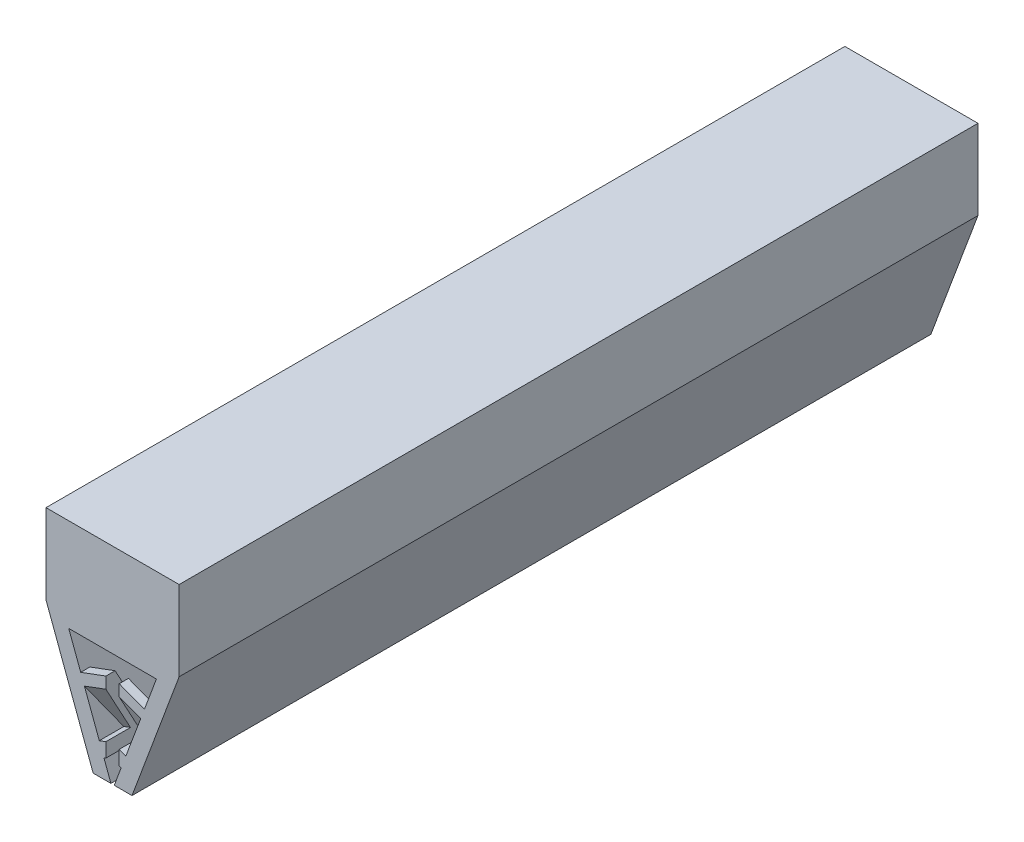
from build123d import *

# Parameters (mm, degrees)
SALIENTE_EXTRUIR1_DEPTH = 60
SALIENTE_EXTRUIR2_REACH = 64.405


with BuildPart() as part:
    # Croquis1 → Saliente-Extruir1 (new, symmetric)
    with BuildSketch(Plane.XY):
        Polygon((-0.25, -17), (-2.91801894, -17), (-10, 2), (-10, 14), (0, 14), (0, 0), (-6.586509369, 0), align=None)
    saliente_extruir1 = extrude(amount=SALIENTE_EXTRUIR1_DEPTH, both=True)

    # Saliente-Extruir2: up to this plane
    saliente_extruir2_end = Plane(origin=(-1, 0, 0), z_dir=(1, 0, 0))
    # Croquis2 → Saliente-Extruir2 (add, up to the surface)
    with BuildSketch(Plane(origin=(-5.783057557, -2.155552847, 0), x_dir=(0, 0, -1), z_dir=(0.9370248323365327, 0.3492627429095367, 0)), mode=Mode.PRIVATE) as saliente_extruir2_sk1:
        Polygon((-60, -12.842106464), (0, -12.842106464), (0, -10.842106464), (-4, -10.842106464), (-6.309401077, -10.842106464), (-14, -10.842106464), (-16.309401077, -10.842106464), (-24, -10.842106464), (-26.309401077, -10.842106464), (-34, -10.842106464), (-36.309401077, -10.842106464), (-44, -10.842106464), (-46.309401077, -10.842106464), (-54, -10.842106464), (-56.309401077, -10.842106464), (-60, -10.842106464), align=None)
    saliente_extruir2_tool1 = split(extrude(saliente_extruir2_sk1.sketch, amount=SALIENTE_EXTRUIR2_REACH, mode=Mode.PRIVATE), bisect_by=saliente_extruir2_end, keep=Keep.BOTH, mode=Mode.PRIVATE)
    # Croquis2 → Saliente-Extruir2 (add, up to the surface)
    with BuildSketch(Plane(origin=(-5.783057557, -2.155552847, 0), x_dir=(0, 0, -1), z_dir=(0.9370248323365327, 0.3492627429095367, 0)), mode=Mode.PRIVATE) as saliente_extruir2_sk2:
        Polygon((-60, -4.449801619), (-56.309401077, -10.842106464), (-54, -10.842106464), (-58.618802154, -2.842106464), (-60, -2.842106464), align=None)
    saliente_extruir2_tool2 = split(extrude(saliente_extruir2_sk2.sketch, amount=SALIENTE_EXTRUIR2_REACH, mode=Mode.PRIVATE), bisect_by=saliente_extruir2_end, keep=Keep.BOTH, mode=Mode.PRIVATE)
    # Croquis2 → Saliente-Extruir2 (add, up to the surface)
    with BuildSketch(Plane(origin=(-5.783057557, -2.155552847, 0), x_dir=(0, 0, -1), z_dir=(0.9370248323365327, 0.3492627429095367, 0)), mode=Mode.PRIVATE) as saliente_extruir2_sk3:
        Polygon((-26.309401077, -10.842106464), (-24, -10.842106464), (-28.618802154, -2.842106464), (-30.92820323, -2.842106464), align=None)
    saliente_extruir2_tool3 = split(extrude(saliente_extruir2_sk3.sketch, amount=SALIENTE_EXTRUIR2_REACH, mode=Mode.PRIVATE), bisect_by=saliente_extruir2_end, keep=Keep.BOTH, mode=Mode.PRIVATE)
    # Croquis2 → Saliente-Extruir2 (add, up to the surface)
    with BuildSketch(Plane(origin=(-5.783057557, -2.155552847, 0), x_dir=(0, 0, -1), z_dir=(0.9370248323365327, 0.3492627429095367, 0)), mode=Mode.PRIVATE) as saliente_extruir2_sk4:
        Polygon((-16.309401077, -10.842106464), (-14, -10.842106464), (-18.618802154, -2.842106464), (-20.92820323, -2.842106464), align=None)
    saliente_extruir2_tool4 = split(extrude(saliente_extruir2_sk4.sketch, amount=SALIENTE_EXTRUIR2_REACH, mode=Mode.PRIVATE), bisect_by=saliente_extruir2_end, keep=Keep.BOTH, mode=Mode.PRIVATE)
    # Croquis2 → Saliente-Extruir2 (add, up to the surface)
    with BuildSketch(Plane(origin=(-5.783057557, -2.155552847, 0), x_dir=(0, 0, -1), z_dir=(0.9370248323365327, 0.3492627429095367, 0)), mode=Mode.PRIVATE) as saliente_extruir2_sk5:
        Polygon((28.618802154, -2.842106464), (24, -10.842106464), (26.309401077, -10.842106464), (30.92820323, -2.842106464), align=None)
    saliente_extruir2_tool5 = split(extrude(saliente_extruir2_sk5.sketch, amount=SALIENTE_EXTRUIR2_REACH, mode=Mode.PRIVATE), bisect_by=saliente_extruir2_end, keep=Keep.BOTH, mode=Mode.PRIVATE)
    # Croquis2 → Saliente-Extruir2 (add, up to the surface)
    with BuildSketch(Plane(origin=(-5.783057557, -2.155552847, 0), x_dir=(0, 0, -1), z_dir=(0.9370248323365327, 0.3492627429095367, 0)), mode=Mode.PRIVATE) as saliente_extruir2_sk6:
        Polygon((34, -10.842106464), (36.309401077, -10.842106464), (40.92820323, -2.842106464), (38.618802154, -2.842106464), align=None)
    saliente_extruir2_tool6 = split(extrude(saliente_extruir2_sk6.sketch, amount=SALIENTE_EXTRUIR2_REACH, mode=Mode.PRIVATE), bisect_by=saliente_extruir2_end, keep=Keep.BOTH, mode=Mode.PRIVATE)
    # Croquis2 → Saliente-Extruir2 (add, up to the surface)
    with BuildSketch(Plane(origin=(-5.783057557, -2.155552847, 0), x_dir=(0, 0, -1), z_dir=(0.9370248323365327, 0.3492627429095367, 0)), mode=Mode.PRIVATE) as saliente_extruir2_sk7:
        Polygon((44, -10.842106464), (46.309401077, -10.842106464), (50.92820323, -2.842106464), (48.618802154, -2.842106464), align=None)
    saliente_extruir2_tool7 = split(extrude(saliente_extruir2_sk7.sketch, amount=SALIENTE_EXTRUIR2_REACH, mode=Mode.PRIVATE), bisect_by=saliente_extruir2_end, keep=Keep.BOTH, mode=Mode.PRIVATE)
    # Croquis2 → Saliente-Extruir2 (add, up to the surface)
    with BuildSketch(Plane(origin=(-5.783057557, -2.155552847, 0), x_dir=(0, 0, -1), z_dir=(0.9370248323365327, 0.3492627429095367, 0)), mode=Mode.PRIVATE) as saliente_extruir2_sk8:
        Polygon((54, -10.842106464), (56.309401077, -10.842106464), (60, -4.449801619), (60, -2.842106464), (58.618802154, -2.842106464), align=None)
    saliente_extruir2_tool8 = split(extrude(saliente_extruir2_sk8.sketch, amount=SALIENTE_EXTRUIR2_REACH, mode=Mode.PRIVATE), bisect_by=saliente_extruir2_end, keep=Keep.BOTH, mode=Mode.PRIVATE)
    # Croquis2 → Saliente-Extruir2 (add, up to the surface)
    with BuildSketch(Plane(origin=(-5.783057557, -2.155552847, 0), x_dir=(0, 0, -1), z_dir=(0.9370248323365327, 0.3492627429095367, 0)), mode=Mode.PRIVATE) as saliente_extruir2_sk9:
        Polygon((0, -12.842106464), (60, -12.842106464), (60, -10.842106464), (56.309401077, -10.842106464), (54, -10.842106464), (46.309401077, -10.842106464), (44, -10.842106464), (36.309401077, -10.842106464), (34, -10.842106464), (26.309401077, -10.842106464), (24, -10.842106464), (16.309401077, -10.842106464), (14, -10.842106464), (6.309401077, -10.842106464), (4, -10.842106464), (0, -10.842106464), align=None)
    saliente_extruir2_tool9 = split(extrude(saliente_extruir2_sk9.sketch, amount=SALIENTE_EXTRUIR2_REACH, mode=Mode.PRIVATE), bisect_by=saliente_extruir2_end, keep=Keep.BOTH, mode=Mode.PRIVATE)
    # Croquis2 → Saliente-Extruir2 (add, up to the surface)
    with BuildSketch(Plane(origin=(-5.783057557, -2.155552847, 0), x_dir=(0, 0, -1), z_dir=(0.9370248323365327, 0.3492627429095367, 0)), mode=Mode.PRIVATE) as saliente_extruir2_sk10:
        Polygon((-44, -10.842106464), (-48.618802154, -2.842106464), (-50.92820323, -2.842106464), (-46.309401077, -10.842106464), align=None)
    saliente_extruir2_tool10 = split(extrude(saliente_extruir2_sk10.sketch, amount=SALIENTE_EXTRUIR2_REACH, mode=Mode.PRIVATE), bisect_by=saliente_extruir2_end, keep=Keep.BOTH, mode=Mode.PRIVATE)
    # Croquis2 → Saliente-Extruir2 (add, up to the surface)
    with BuildSketch(Plane(origin=(-5.783057557, -2.155552847, 0), x_dir=(0, 0, -1), z_dir=(0.9370248323365327, 0.3492627429095367, 0)), mode=Mode.PRIVATE) as saliente_extruir2_sk11:
        Polygon((-34, -10.842106464), (-38.618802154, -2.842106464), (-40.92820323, -2.842106464), (-36.309401077, -10.842106464), align=None)
    saliente_extruir2_tool11 = split(extrude(saliente_extruir2_sk11.sketch, amount=SALIENTE_EXTRUIR2_REACH, mode=Mode.PRIVATE), bisect_by=saliente_extruir2_end, keep=Keep.BOTH, mode=Mode.PRIVATE)
    # Croquis2 → Saliente-Extruir2 (add, up to the surface)
    with BuildSketch(Plane(origin=(-5.783057557, -2.155552847, 0), x_dir=(0, 0, -1), z_dir=(0.9370248323365327, 0.3492627429095367, 0)), mode=Mode.PRIVATE) as saliente_extruir2_sk12:
        Polygon((-10.92820323, -2.842106464), (-6.309401077, -10.842106464), (-4, -10.842106464), (-8.618802154, -2.842106464), align=None)
    saliente_extruir2_tool12 = split(extrude(saliente_extruir2_sk12.sketch, amount=SALIENTE_EXTRUIR2_REACH, mode=Mode.PRIVATE), bisect_by=saliente_extruir2_end, keep=Keep.BOTH, mode=Mode.PRIVATE)
    # Croquis2 → Saliente-Extruir2 (add, up to the surface)
    with BuildSketch(Plane(origin=(-5.783057557, -2.155552847, 0), x_dir=(0, 0, -1), z_dir=(0.9370248323365327, 0.3492627429095367, 0)), mode=Mode.PRIVATE) as saliente_extruir2_sk13:
        Polygon((4, -10.842106464), (8.618802154, -2.842106464), (10.92820323, -2.842106464), (6.309401077, -10.842106464), align=None)
    saliente_extruir2_tool13 = split(extrude(saliente_extruir2_sk13.sketch, amount=SALIENTE_EXTRUIR2_REACH, mode=Mode.PRIVATE), bisect_by=saliente_extruir2_end, keep=Keep.BOTH, mode=Mode.PRIVATE)
    # Croquis2 → Saliente-Extruir2 (add, up to the surface)
    with BuildSketch(Plane(origin=(-5.783057557, -2.155552847, 0), x_dir=(0, 0, -1), z_dir=(0.9370248323365327, 0.3492627429095367, 0)), mode=Mode.PRIVATE) as saliente_extruir2_sk14:
        Polygon((14, -10.842106464), (18.618802154, -2.842106464), (20.92820323, -2.842106464), (16.309401077, -10.842106464), align=None)
    saliente_extruir2_tool14 = split(extrude(saliente_extruir2_sk14.sketch, amount=SALIENTE_EXTRUIR2_REACH, mode=Mode.PRIVATE), bisect_by=saliente_extruir2_end, keep=Keep.BOTH, mode=Mode.PRIVATE)
    saliente_extruir2 = saliente_extruir2_tool1.solids().sort_by_distance((-1.647051, -13.251901, 30))[0] + saliente_extruir2_tool2.solids().sort_by_distance((-3.342446, -8.703383, 57.344356))[0] + saliente_extruir2_tool3.solids().sort_by_distance((-3.393365, -8.566777, 27.464102))[0] + saliente_extruir2_tool4.solids().sort_by_distance((-3.393365, -8.566777, 17.464102))[0] + saliente_extruir2_tool5.solids().sort_by_distance((-3.393365, -8.566777, -27.464102))[0] + saliente_extruir2_tool6.solids().sort_by_distance((-3.393365, -8.566777, -37.464102))[0] + saliente_extruir2_tool7.solids().sort_by_distance((-3.393365, -8.566777, -47.464102))[0] + saliente_extruir2_tool8.solids().sort_by_distance((-3.342446, -8.703383, -57.344356))[0] + saliente_extruir2_tool9.solids().sort_by_distance((-1.647051, -13.251901, -30))[0] + saliente_extruir2_tool10.solids().sort_by_distance((-3.393365, -8.566777, 47.464102))[0] + saliente_extruir2_tool11.solids().sort_by_distance((-3.393365, -8.566777, 37.464102))[0] + saliente_extruir2_tool12.solids().sort_by_distance((-3.393365, -8.566777, 7.464102))[0] + saliente_extruir2_tool13.solids().sort_by_distance((-3.393365, -8.566777, -7.464102))[0] + saliente_extruir2_tool14.solids().sort_by_distance((-3.393365, -8.566777, -17.464102))[0]
    add(saliente_extruir2)

    # Simetría1: Saliente-Extruir1, Saliente-Extruir2 across plane
    add(saliente_extruir1.mirror(Plane(origin=(0, 0, 0), x_dir=(0, 0, 1), z_dir=(1, 0, 0))))
    add(saliente_extruir2.mirror(Plane(origin=(0, 0, 0), x_dir=(0, 0, 1), z_dir=(1, 0, 0))))


solid = part.part
